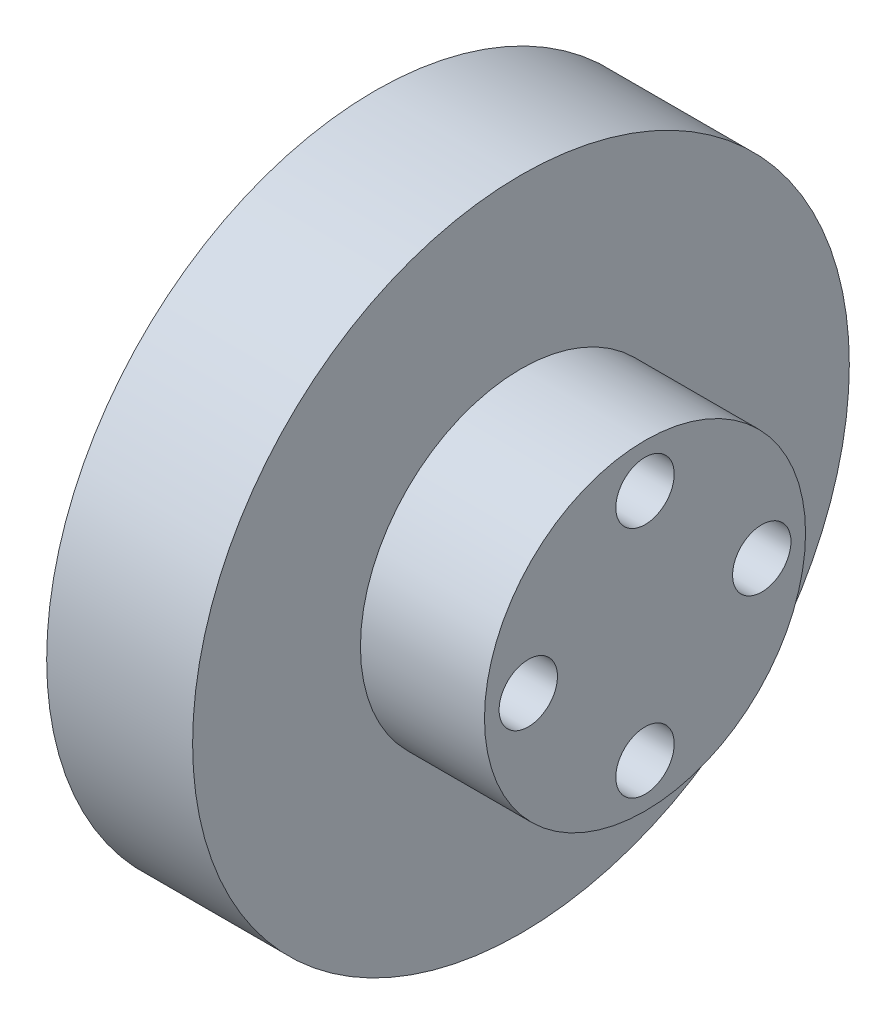
from build123d import *

# Parameters (mm, degrees)
SKETCH3_R           = 22.5
BOSS_EXTRUDE1_DEPTH = 10
SKETCH4_R           = 11
BOSS_EXTRUDE2_DEPTH = 8.5
SKETCH5_R           = 2
CUT_EXTRUDE1_DEPTH  = 37.806928696


with BuildPart() as part:
    # Sketch3 → Boss-Extrude1 (new body)
    with BuildSketch(Plane(origin=(0, 0, 0), x_dir=(0, 0, -1), z_dir=(1, 0, 0))):
        Circle(SKETCH3_R)
    extrude(amount=BOSS_EXTRUDE1_DEPTH)

    # Sketch4 → Boss-Extrude2 (add)
    with BuildSketch(Plane(origin=(10, 0, 0), x_dir=(0, 0, -1), z_dir=(1, 0, 0))):
        Circle(SKETCH4_R)
    extrude(amount=BOSS_EXTRUDE2_DEPTH)

    # Sketch5 → Cut-Extrude1 (cut, through all)
    with BuildSketch(Plane(origin=(18.5, 0, 0), x_dir=(0, 0, -1), z_dir=(1, 0, 0))):
        with Locations((0, 8)):
            Circle(SKETCH5_R)
        with Locations((8, 0)):
            Circle(SKETCH5_R)
        with Locations((0, -8)):
            Circle(SKETCH5_R)
        with Locations((-8, 0)):
            Circle(SKETCH5_R)
    extrude(amount=-CUT_EXTRUDE1_DEPTH, mode=Mode.SUBTRACT)


solid = part.part
